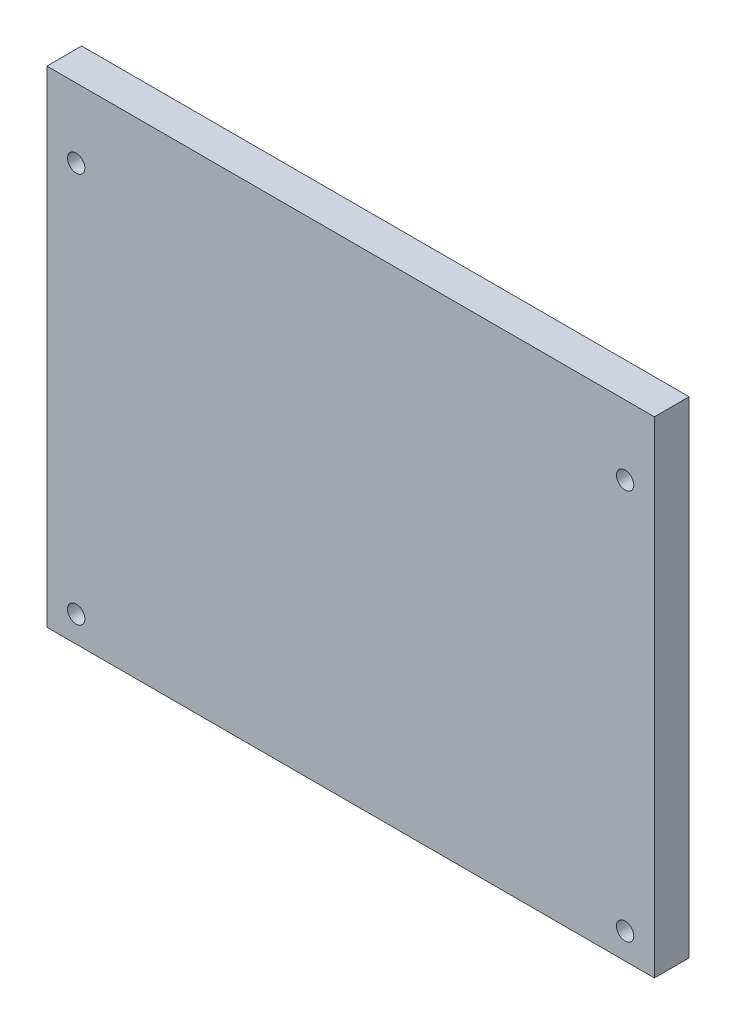
from build123d import *

# Parameters (mm, degrees)
SKETCH1_W           = 444.5
SKETCH1_H           = 355.6
BOSS_EXTRUDE1_DEPTH = 25.4
SKETCH2_R           = 6.35
CUT_EXTRUDE1_DEPTH  = 570.804150564


with BuildPart() as part:
    # Sketch1 → Boss-Extrude1 (new body)
    with BuildSketch(Plane.XY):
        with Locations((222.25, 177.8)):
            Rectangle(SKETCH1_W, SKETCH1_H)
    extrude(amount=BOSS_EXTRUDE1_DEPTH)

    # Sketch2 → Cut-Extrude1 (cut, through all)
    with BuildSketch(Plane.XY):
        with Locations((21.4376, 19.05)):
            Circle(SKETCH2_R)
        with Locations((423.0624, 19.05)):
            Circle(SKETCH2_R)
        with Locations((21.4376, 304.8)):
            Circle(SKETCH2_R)
        with Locations((423.0624, 304.8)):
            Circle(SKETCH2_R)
    extrude(amount=CUT_EXTRUDE1_DEPTH, mode=Mode.SUBTRACT)


solid = part.part
